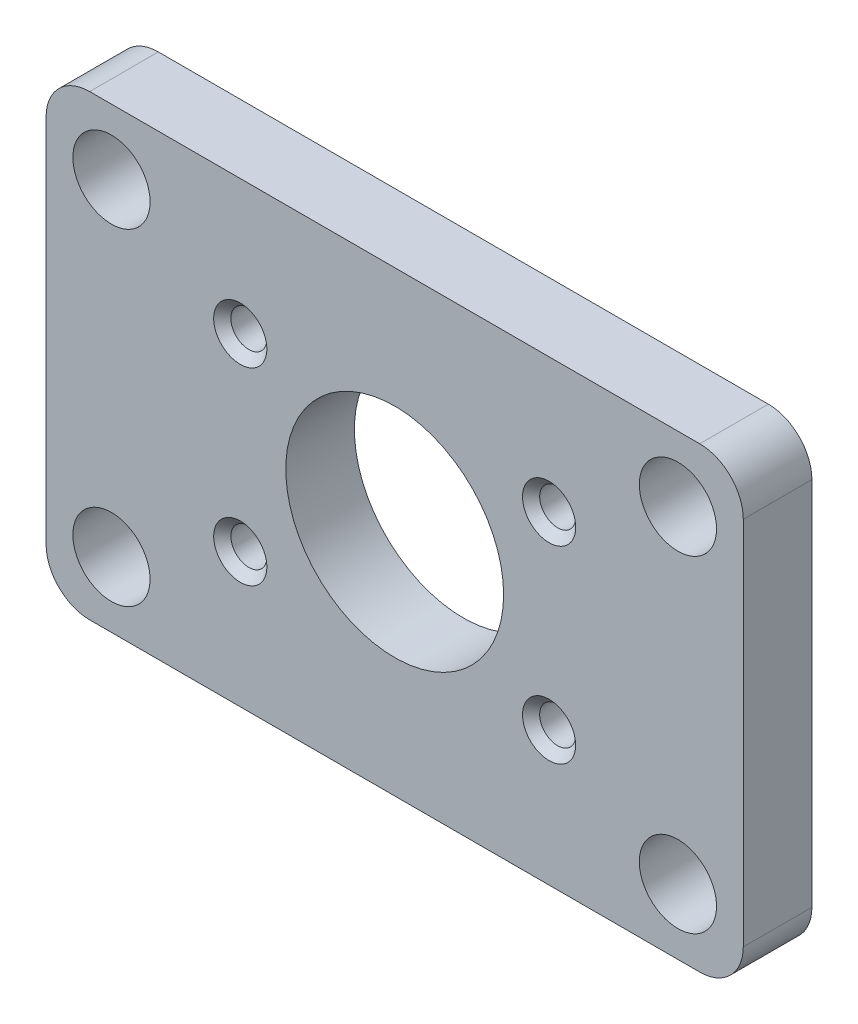
from build123d import *

# Parameters (mm, degrees)
SKETCH1_W           = 40.64
SKETCH1_H           = 26.67
SKETCH1_R           = 2.25
SKETCH1_R_2         = 1.05
SKETCH1_R_3         = 6.35
BOSS_EXTRUDE1_DEPTH = 4
FILLET1_R           = 2.54
CHAMFER1_SIZE       = 0.5


with BuildPart() as part:
    # Sketch1 → Boss-Extrude1 (new body)
    with BuildSketch(Plane.XY):
        Rectangle(SKETCH1_W, SKETCH1_H)
        with Locations((-16.51, 9.525)):
            Circle(SKETCH1_R, mode=Mode.SUBTRACT)
        with Locations((16.51, 9.525)):
            Circle(SKETCH1_R, mode=Mode.SUBTRACT)
        with Locations(Location((16.51, -9.525, 0), (0, 0, 180))):
            Circle(SKETCH1_R, mode=Mode.SUBTRACT)
        with Locations(Location((-16.51, -9.525, 0), (0, 0, 180))):
            Circle(SKETCH1_R, mode=Mode.SUBTRACT)
        with Locations((-9.00049, 5.50037)):
            Circle(SKETCH1_R_2, mode=Mode.SUBTRACT)
        with Locations((9.00049, -5.50037)):
            Circle(SKETCH1_R_2, mode=Mode.SUBTRACT)
        Circle(SKETCH1_R_3, mode=Mode.SUBTRACT)
        with Locations(Location((-9.00049, -5.50037, 0), (0, 0, 180))):
            Circle(SKETCH1_R_2, mode=Mode.SUBTRACT)
        with Locations(Location((9.00049, 5.50037, 0), (0, 0, 180))):
            Circle(SKETCH1_R_2, mode=Mode.SUBTRACT)
    extrude(amount=BOSS_EXTRUDE1_DEPTH)

    # Fillet1
    fillet1_edges = [part.edges().sort_by_distance(p)[0] for p in [
        (-20.32, 13.335, 2),
        (20.32, 13.335, 2),
        (20.32, -13.335, 2),
        (-20.32, -13.335, 2),
    ]]
    fillet(fillet1_edges, radius=FILLET1_R)

    # Chamfer1
    chamfer1_edges = [part.edges().sort_by_distance(p)[0] for p in [
        (7.95049, -5.50037, 4),
        (-10.05049, 5.50037, 4),
        (-7.95049, -5.50037, 4),
        (10.05049, 5.50037, 4),
    ]]
    chamfer(chamfer1_edges, length=CHAMFER1_SIZE)


solid = part.part
